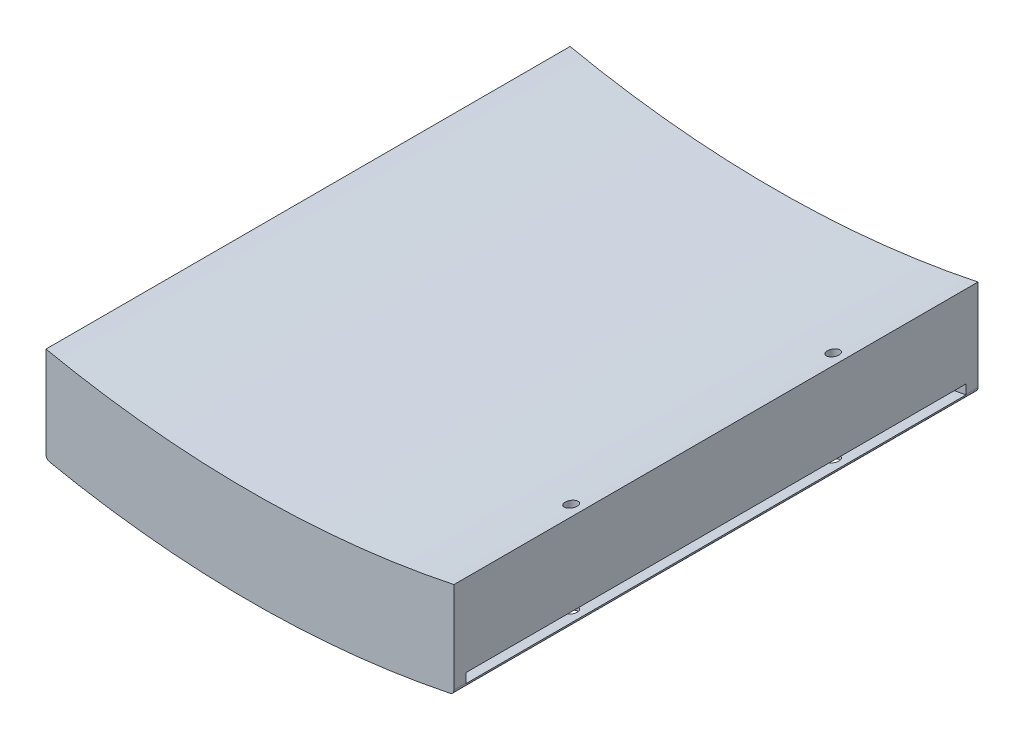
from build123d import *

# Parameters (mm, degrees)
BOSS_EXTRUDE2_DEPTH     = 279.4
CUT_EXTRUDE1_DEPTH      = 279.4
FILLET1_R               = 2.54
SKETCH7_W               = 192.0875
SKETCH7_H               = 254
CUT_EXTRUDE2_DEPTH      = 44.45
SKETCH8_W               = 6.173248721
SKETCH8_H               = 35.639061591
BOSS_EXTRUDE3_DEPTH     = 258.064
CUT_EXTRUDE3_DEPTH      = 260.35
CUT_EXTRUDE3_DEPTH_BACK = 6.35
CUT_EXTRUDE4_DEPTH      = 260.35
CUT_EXTRUDE4_DEPTH_BACK = 6.35
BOSS_EXTRUDE4_DEPTH     = 254
SKETCH18_R              = 3.175
CUT_EXTRUDE5_DEPTH      = 71.12


with BuildPart() as part:
    # CrossSection → Boss-Extrude2 (new body)
    with BuildSketch(Plane.XY):
        with BuildLine():
            Line((108.74375, 11.322324676), (108.74375, -50.8))
            Line((108.74375, -50.8), (-108.74375, -50.8))
            Line((-108.74375, -50.8), (-108.74375, 11.322324676))
            ThreePointArc((-108.74375, 11.322324676), (0, 0), (108.74375, 11.322324676))
        make_face()
    extrude(amount=BOSS_EXTRUDE2_DEPTH)

    # Sketch4 → Cut-Extrude1 (cut)
    with BuildSketch(Plane(origin=(0, 0, 0), x_dir=(-1, 0, 0), z_dir=(0, 0, -1))):
        with BuildLine():
            ThreePointArc((0, -50.8), (-54.665798723, -47.96178867), (-108.74375, -39.477675324))
            Line((-108.74375, -39.477675324), (-108.74375, -50.8))
            Line((-108.74375, -50.8), (0, -50.8))
        make_face()
        with BuildLine():
            ThreePointArc((108.74375, -39.477675324), (54.665798723, -47.96178867), (0, -50.8))
            Line((0, -50.8), (108.74375, -50.8))
            Line((108.74375, -50.8), (108.74375, -39.477675324))
        make_face()
    extrude(amount=-CUT_EXTRUDE1_DEPTH, mode=Mode.SUBTRACT)

    # Fillet1
    fillet1_edges = [part.edges().sort_by_distance(p)[0] for p in [
        (108.74375, -39.477675324, 139.7),
        (-108.74375, -39.477675324, 139.7),
    ]]
    fillet(fillet1_edges, radius=FILLET1_R)

    # Sketch7 → Cut-Extrude2 (cut)
    with BuildSketch(Plane(origin=(0, -50.8, 0), x_dir=(1, 0, 0), z_dir=(0, 1, 0))):
        with Locations((0, -139.7)):
            Rectangle(SKETCH7_W, SKETCH7_H)
    extrude(amount=CUT_EXTRUDE2_DEPTH, mode=Mode.SUBTRACT)

    # Sketch8 → Boss-Extrude3 (add)
    with BuildSketch(Plane.XY.offset(12.7)):
        with Locations((3.086624361, -24.169530796)):
            Rectangle(SKETCH8_W, SKETCH8_H)
        with Locations((-3.086624361, -24.169530796)):
            Rectangle(SKETCH8_W, SKETCH8_H)
    extrude(amount=BOSS_EXTRUDE3_DEPTH)

    # Sketch13 → Cut-Extrude3 (cut, two sides: drawn at the far end of the back side and taken through both)
    with BuildSketch(Plane.XY.offset(12.7).offset(-CUT_EXTRUDE3_DEPTH_BACK)):
        with BuildLine():
            ThreePointArc((-96.04375, -40.123592373), (-48.223527841, -46.727181022), (0, -48.934530782))
            Line((0, -48.934530782), (0, -43.854530782))
            ThreePointArc((0, -43.854530782), (-48.223527841, -41.647181022), (-96.04375, -35.043592373))
            Line((-96.04375, -35.043592373), (-96.04375, -37.583592373))
            Line((-96.04375, -37.583592373), (-96.04375, -40.123592373))
        make_face()
        with BuildLine():
            Line((0, -43.854530782), (0, -48.934530782))
            ThreePointArc((0, -48.934530782), (48.223527841, -46.727181022), (96.04375, -40.123592373))
            Line((96.04375, -40.123592373), (96.04375, -37.583592373))
            Line((96.04375, -37.583592373), (96.04375, -35.043592373))
            ThreePointArc((96.04375, -35.043592373), (48.223527841, -41.647181022), (0, -43.854530782))
        make_face()
    extrude(amount=CUT_EXTRUDE3_DEPTH + CUT_EXTRUDE3_DEPTH_BACK, mode=Mode.SUBTRACT)

    # Sketch14 → Cut-Extrude4 (cut, two sides: drawn at the far end of the back side and taken through both)
    with BuildSketch(Plane(origin=(0, 0, 266.7), x_dir=(-1, 0, 0), z_dir=(0, 0, -1)).offset(-CUT_EXTRUDE4_DEPTH_BACK)):
        with BuildLine():
            Line((96.04375, -35.043592373), (96.04375, -40.123592373))
            ThreePointArc((96.04375, -40.123592373), (-28.026510339, -48.189989717), (-150.541934286, -27.012946445))
            Line((-150.541934286, -27.012946445), (-150.541934286, -21.932946445))
            ThreePointArc((-150.541934286, -21.932946445), (-28.026510339, -43.109989717), (96.04375, -35.043592373))
        make_face()
    extrude(amount=CUT_EXTRUDE4_DEPTH + CUT_EXTRUDE4_DEPTH_BACK, mode=Mode.SUBTRACT)

    # Sketch15 → Boss-Extrude4 (add)
    with BuildSketch(Plane(origin=(0, 0, 266.7), x_dir=(-1, 0, 0), z_dir=(0, 0, -1))):
        with BuildLine():
            Line((6.173248721, -43.818432493), (6.173248721, -41.989061591))
            Line((6.173248721, -41.989061591), (-6.173248721, -41.989061591))
            Line((-6.173248721, -41.989061591), (-6.173248721, -43.818432493))
            ThreePointArc((-6.173248721, -43.818432493), (0, -43.854530782), (6.173248721, -43.818432493))
        make_face()
    extrude(amount=BOSS_EXTRUDE4_DEPTH)

    # Sketch18 → Cut-Extrude5 (cut)
    with BuildSketch(Plane(origin=(0, -50.8, 0), x_dir=(1, 0, 0), z_dir=(0, 1, 0))):
        with Locations(Location((101.380501252, -209.55, 0), (0, 0, 90))):
            Circle(SKETCH18_R)
        with Locations(Location((101.380501252, -69.85, 0), (0, 0, 90))):
            Circle(SKETCH18_R)
    extrude(amount=CUT_EXTRUDE5_DEPTH, mode=Mode.SUBTRACT)


solid = part.part
